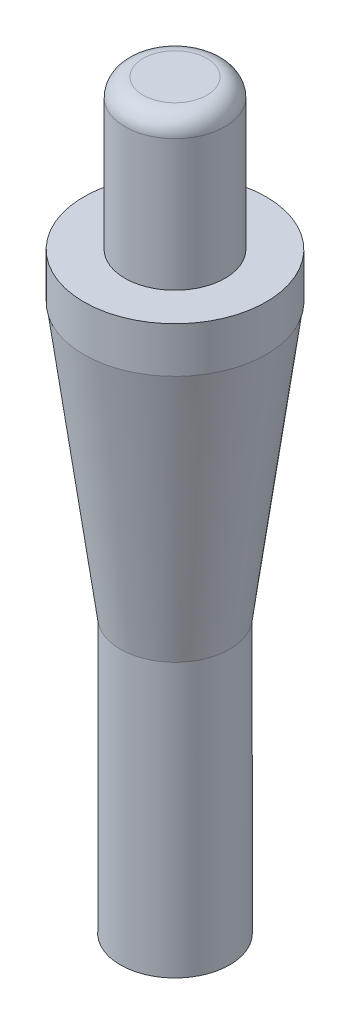
from build123d import *

# Parameters (mm, degrees)
FILLET1_R      = 1
CHAMFER1_SIZE  = 15
CHAMFER1_SIZE2 = 1.974787464


with BuildPart() as part:
    # Sketch1 → Revolve1 (revolve)
    with BuildSketch(Plane(origin=(0, 0, 0), x_dir=(0, 0, -1), z_dir=(1, 0, 0))):
        Polygon((-2.75, 25.7), (-2.75, 17.5), (-5, 17.5), (-5, 15), (-3, 15), (-3, -15), (-1.6, -15), (-1.6, 10), (0, 10), (0, 25.7), align=None)
    revolve(axis=Axis((0, 26.571382603, 0), (0, -1, 0)))

    # Fillet1
    fillet1_edges = [part.edges().sort_by_distance(p)[0] for p in [
        (0, 25.7, -2.75),
    ]]
    fillet(fillet1_edges, radius=FILLET1_R)

    # Chamfer1
    chamfer1_edges = [part.edges().sort_by_distance(p)[0] for p in [
        (0, 15, -3),
    ]]
    chamfer1_side = [part.faces().sort_by_distance(p)[0] for p in [
        (0, 0, -3),
    ]]
    chamfer(chamfer1_edges, length=CHAMFER1_SIZE, length2=CHAMFER1_SIZE2, reference=chamfer1_side[0])


solid = part.part
